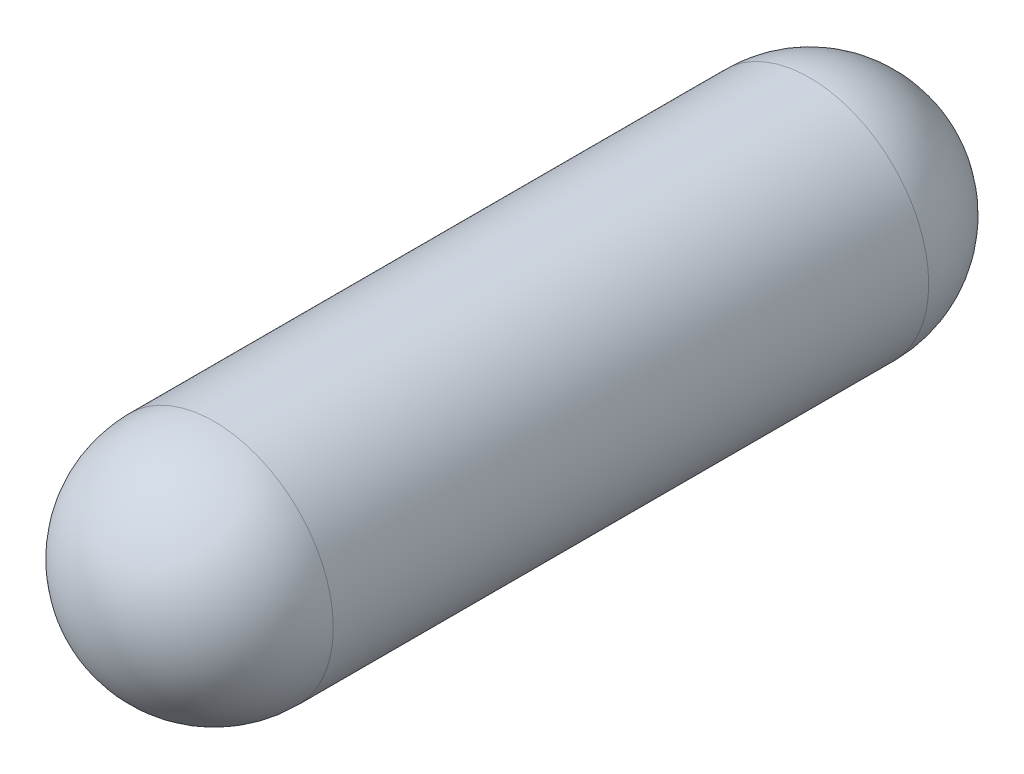
from build123d import *

# Parameters (mm, degrees)
SKETCH1_R           = 2
BOSS_EXTRUDE1_DEPTH = 10


with BuildPart() as part:
    # Sketch1 → Boss-Extrude1 (new body)
    with BuildSketch(Plane.XY):
        Circle(SKETCH1_R)
    extrude(amount=BOSS_EXTRUDE1_DEPTH)

    # Sketch2 → Revolve1 (revolve)
    with BuildSketch(Plane(origin=(0, 0, 0), x_dir=(1, 0, 0), z_dir=(0, 1, 0))):
        with BuildLine():
            Line((0, 2), (0, -2))
            ThreePointArc((0, -2), (2, 0), (0, 2))
        make_face()
        with BuildLine():
            Line((0, -8), (0, -12))
            ThreePointArc((0, -12), (2, -10), (0, -8))
        make_face()
    revolve(axis=Axis((0, 0, -2), (0, 0, 1)))


solid = part.part
